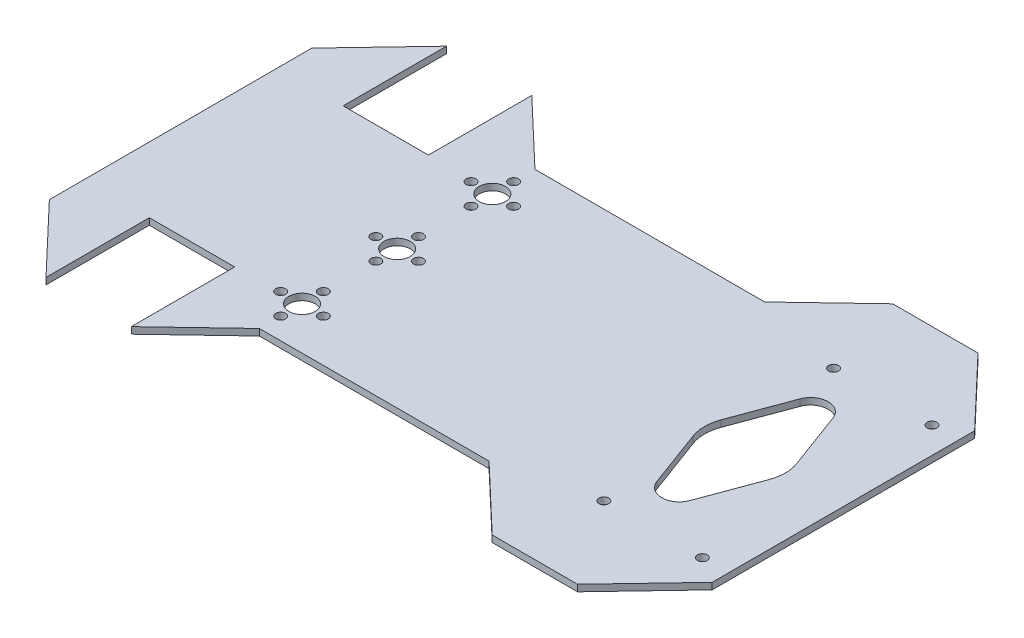
from build123d import *

# Parameters (mm, degrees)
BOSS_EXTRUDE1_DEPTH = 2
SKETCH5_W           = 26
SKETCH5_H           = 31.5
CUT_EXTRUDE3_DEPTH  = 119.021390944
CUT_EXTRUDE4_DEPTH  = 119.021390944
SKETCH8_R           = 1.5
SKETCH8_R_2         = 4
CUT_EXTRUDE5_DEPTH  = 119.021390944
SKETCH9_R           = 1.5
CUT_EXTRUDE6_DEPTH  = 119.021390944


with BuildPart() as part:
    # Sketch1 → Boss-Extrude1 (new body)
    with BuildSketch(Plane(origin=(0, 0, 0), x_dir=(1, 0, 0), z_dir=(0, 1, 0))):
        Polygon((-55, 61.024984395), (-35, 42), (35, 42), (55, 61.024984395), (81, 61.024984395), (101, 40), (101, -40), (81, -61.024984395), (55, -61.024984395), (35, -42), (-35, -42), (-55, -61.024984395), (-81, -61.024984395), (-101, -40), (-101, 40), (-81, 61.024984395), align=None)
    extrude(amount=BOSS_EXTRUDE1_DEPTH)

    # Sketch5 → Cut-Extrude3 (cut, through all)
    with BuildSketch(Plane.XZ):
        with Locations((-68, -45.274984395)):
            Rectangle(SKETCH5_W, SKETCH5_H)
        with Locations((-68, 45.274984395)):
            Rectangle(SKETCH5_W, SKETCH5_H)
    extrude(amount=-CUT_EXTRUDE3_DEPTH, mode=Mode.SUBTRACT)

    # Sketch4 → Cut-Extrude4 (cut, through all)
    with BuildSketch(Plane(origin=(0, 2, 0), x_dir=(1, 0, 0), z_dir=(0, 1, 0))):
        with BuildLine():
            Line((76.016587908, 21.859125), (82.533463787, 4.27425))
            ThreePointArc((82.533463787, 4.27425), (83.3, 0), (82.533463787, -4.27425))
            Line((82.533463787, -4.27425), (76.016587908, -21.859125))
            ThreePointArc((76.016587908, -21.859125), (71, -25.35), (65.983412092, -21.859125))
            Line((65.983412092, -21.859125), (59.466536213, -4.27425))
            ThreePointArc((59.466536213, -4.27425), (58.7, 0), (59.466536213, 4.27425))
            Line((59.466536213, 4.27425), (65.983412092, 21.859125))
            ThreePointArc((65.983412092, 21.859125), (71, 25.35), (76.016587908, 21.859125))
        make_face()
    extrude(amount=-CUT_EXTRUDE4_DEPTH, mode=Mode.SUBTRACT)

    # Sketch8 → Cut-Extrude5 (cut, through all)
    with BuildSketch(Plane(origin=(0, 2, 0), x_dir=(1, 0, 0), z_dir=(0, 1, 0))):
        with Locations(Location((-35, -22.5, 0), (0, 0, 270))):
            Circle(SKETCH8_R)
        with Locations(Location((-41.5, -29, 0), (0, 0, 270))):
            Circle(SKETCH8_R)
        with Locations(Location((-35, -35.5, 0), (0, 0, 270))):
            Circle(SKETCH8_R)
        with Locations(Location((-28.5, -29, 0), (0, 0, 270))):
            Circle(SKETCH8_R)
        with Locations(Location((-35, -29, 0), (0, 0, 270))):
            Circle(SKETCH8_R_2)
        with Locations(Location((-35, 29, 0), (0, 0, 90))):
            Circle(SKETCH8_R_2)
        with Locations(Location((-28.5, 29, 0), (0, 0, 90))):
            Circle(SKETCH8_R)
        with Locations(Location((-35, 35.5, 0), (0, 0, 90))):
            Circle(SKETCH8_R)
        with Locations(Location((-41.5, 29, 0), (0, 0, 90))):
            Circle(SKETCH8_R)
        with Locations(Location((-35, 22.5, 0), (0, 0, 90))):
            Circle(SKETCH8_R)
        with Locations(Location((-35, 0, 0), (0, 0, 270))):
            Circle(SKETCH8_R_2)
        with Locations(Location((-35, 6.5, 0), (0, 0, 270))):
            Circle(SKETCH8_R)
        with Locations(Location((-28.5, 0, 0), (0, 0, 270))):
            Circle(SKETCH8_R)
        with Locations(Location((-41.5, 0, 0), (0, 0, 270))):
            Circle(SKETCH8_R)
        with Locations(Location((-35, -6.5, 0), (0, 0, 270))):
            Circle(SKETCH8_R)
    extrude(amount=-CUT_EXTRUDE5_DEPTH, mode=Mode.SUBTRACT)

    # Sketch9 → Cut-Extrude6 (cut, through all)
    with BuildSketch(Plane(origin=(0, 2, 0), x_dir=(1, 0, 0), z_dir=(0, 1, 0))):
        with Locations(Location((93, 35, 0), (0, 0, 270))):
            Circle(SKETCH9_R)
        with Locations(Location((63, 35, 0), (0, 0, 270))):
            Circle(SKETCH9_R)
        with Locations(Location((63, -35, 0), (0, 0, 90))):
            Circle(SKETCH9_R)
        with Locations(Location((93, -35, 0), (0, 0, 90))):
            Circle(SKETCH9_R)
    extrude(amount=-CUT_EXTRUDE6_DEPTH, mode=Mode.SUBTRACT)


solid = part.part
